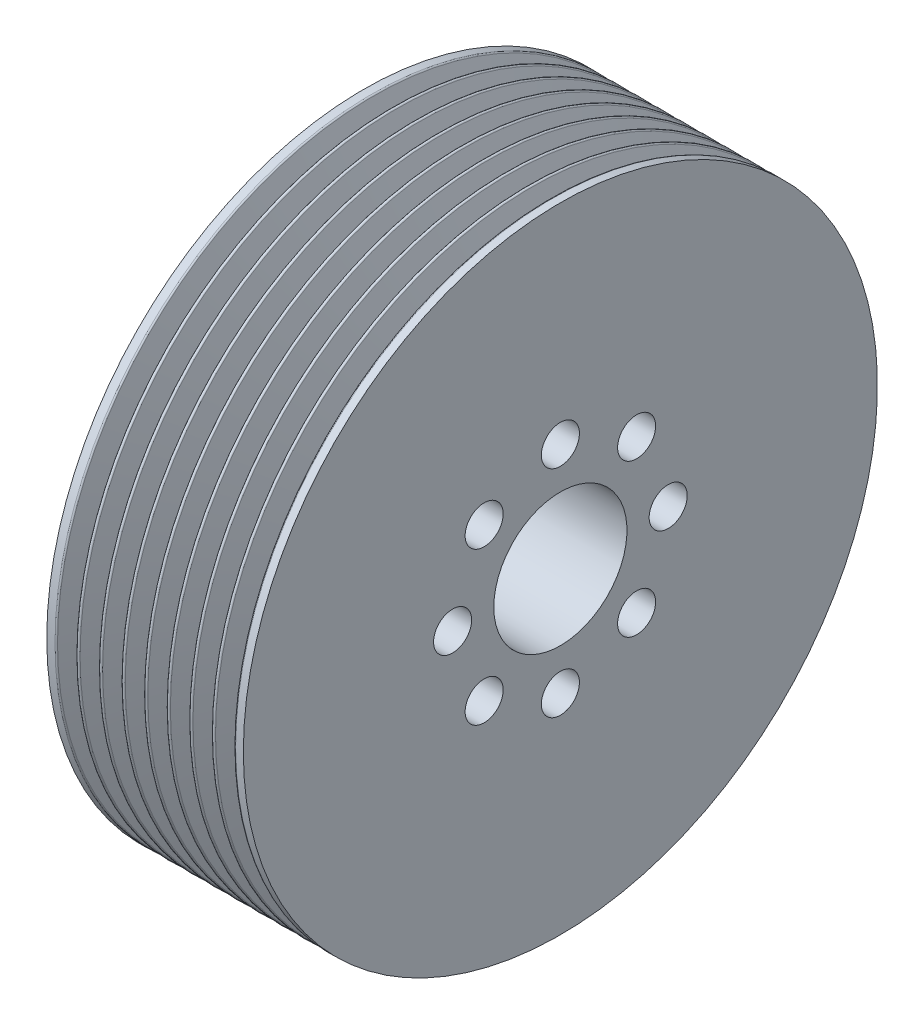
from build123d import *

# Parameters (mm, degrees)
LPATTERN1_COUNT    = 8
LPATTERN1_PITCH    = 3.56
SKETCH3_R          = 3
CUT_EXTRUDE1_DEPTH = 17.5


with BuildPart() as part:
    # Sketch1 → Revolve1 (revolve)
    with BuildSketch(Plane.XY, mode=Mode.PRIVATE) as revolve1_sk:
        Polygon((49, 10.5), (49, 50), (18, 50), (18, 21.5), (31.5, 21.5), (31.5, 10.5), align=None)
    revolve(revolve1_sk.sketch.rotate(Axis((0, 0, 0), (1, 0, 0)), 90), axis=Axis((0, 0, 0), (1, 0, 0)))

    # Sketch2 → Cut-Revolve1 (revolve, cut)
    with BuildSketch(Plane.XY, mode=Mode.PRIVATE) as cut_revolve1_sk:
        with BuildLine():
            Line((47.545831953, 49.837551845), (46.281001657, 46.45460955))
            ThreePointArc((46.281001657, 46.45460955), (46, 46.259671764), (45.718998343, 46.45460955))
            Line((45.718998343, 46.45460955), (44.454168047, 49.837551845))
            ThreePointArc((44.454168047, 49.837551845), (44.362499191, 49.955411734), (44.22, 50))
            Line((44.22, 50), (47.78, 50))
            ThreePointArc((47.78, 50), (47.637500809, 49.955411734), (47.545831953, 49.837551845))
        make_face()
    cut_revolve1 = revolve(cut_revolve1_sk.sketch.rotate(Axis((0, 0, 0), (1, 0, 0)), 90), axis=Axis((0, 0, 0), (1, 0, 0)), mode=Mode.SUBTRACT)

    # LPattern1: Cut-Revolve1 ×8
    with Locations(*[(-i * LPATTERN1_PITCH, 0, 0) for i in range(1, LPATTERN1_COUNT)]):
        add(cut_revolve1, mode=Mode.SUBTRACT)

    # Sketch3 → Cut-Extrude1 (cut)
    with BuildSketch(Plane(origin=(49, 0, 0), x_dir=(0, 0, -1), z_dir=(1, 0, 0))):
        with Locations((0, 17)):
            Circle(SKETCH3_R)
        with Locations((12.02081528, 12.02081528)):
            Circle(SKETCH3_R)
        with Locations((17, 0)):
            Circle(SKETCH3_R)
        with Locations((12.02081528, -12.02081528)):
            Circle(SKETCH3_R)
        with Locations((0, -17)):
            Circle(SKETCH3_R)
        with Locations((-12.02081528, -12.02081528)):
            Circle(SKETCH3_R)
        with Locations((-17, 0)):
            Circle(SKETCH3_R)
        with Locations((-12.02081528, 12.02081528)):
            Circle(SKETCH3_R)
    extrude(amount=-CUT_EXTRUDE1_DEPTH, mode=Mode.SUBTRACT)


solid = part.part
